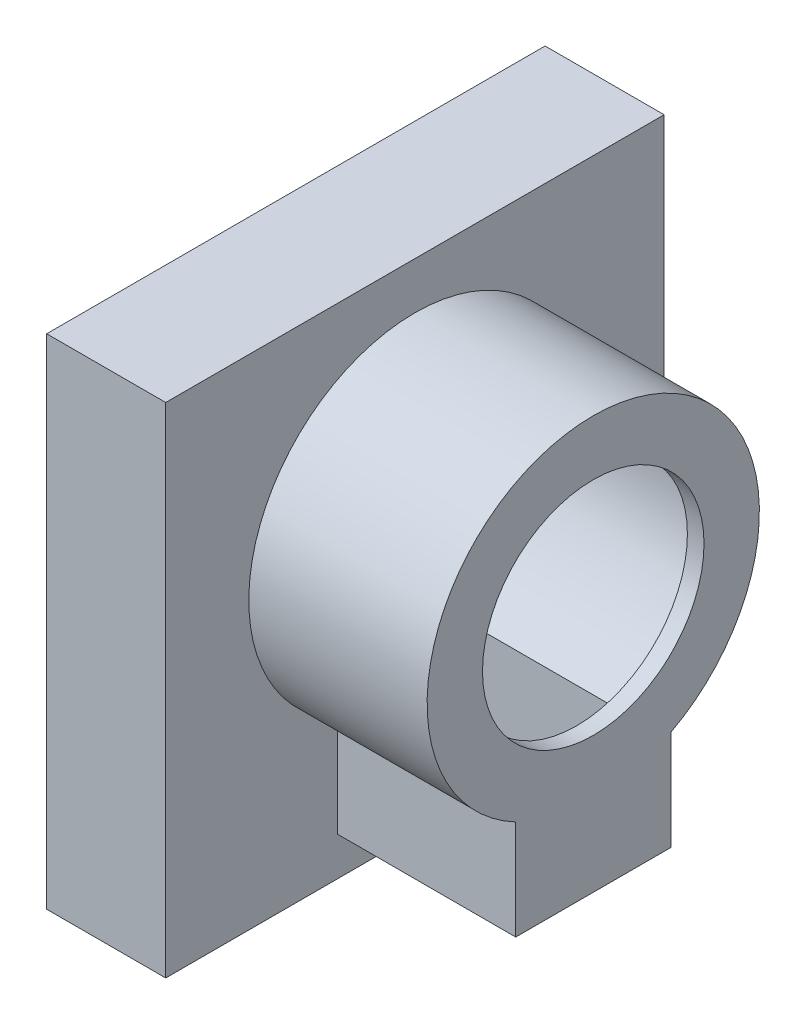
from build123d import *

# Parameters (mm, degrees)
SKETCH2_W           = 18
SKETCH2_H           = 18
BOSS_EXTRUDE1_DEPTH = 4.3
BOSS_EXTRUDE2_DEPTH = 6.44
SHELL2_T            = -0.6
SKETCH5_R           = 4
CUT_EXTRUDE1_DEPTH  = 17.653756333


with BuildPart() as part:
    # Sketch2 → Boss-Extrude1 (new body)
    with BuildSketch(Plane(origin=(0, 0, 0), x_dir=(0, 0, -1), z_dir=(1, 0, 0))):
        Rectangle(SKETCH2_W, SKETCH2_H)
    extrude(amount=BOSS_EXTRUDE1_DEPTH)

    # Sketch4 → Boss-Extrude2 (add)
    with BuildSketch(Plane(origin=(4.3, 0, 0), x_dir=(0, 0, -1), z_dir=(1, 0, 0))):
        with BuildLine():
            Line((-2.8, -7.6), (2.8, -7.6))
            Line((2.8, -7.6), (2.8, -4))
            ThreePointArc((2.8, -4), (0, 7.306599665), (-2.8, -4))
            Line((-2.8, -4), (-2.8, -7.6))
        make_face()
    extrude(amount=BOSS_EXTRUDE2_DEPTH)

    # Shell2
    shell2_openings = [part.faces().sort_by_distance(p)[0] for p in [
        (0, 0, 0),
    ]]
    offset(amount=SHELL2_T, openings=shell2_openings, kind=Kind.INTERSECTION)

    # Sketch5 → Cut-Extrude1 (cut, through all)
    with BuildSketch(Plane(origin=(10.74, 0, 0), x_dir=(0, 0, -1), z_dir=(1, 0, 0))):
        with Locations((0, 1.306599665)):
            Circle(SKETCH5_R)
    extrude(amount=-CUT_EXTRUDE1_DEPTH, mode=Mode.SUBTRACT)


solid = part.part
